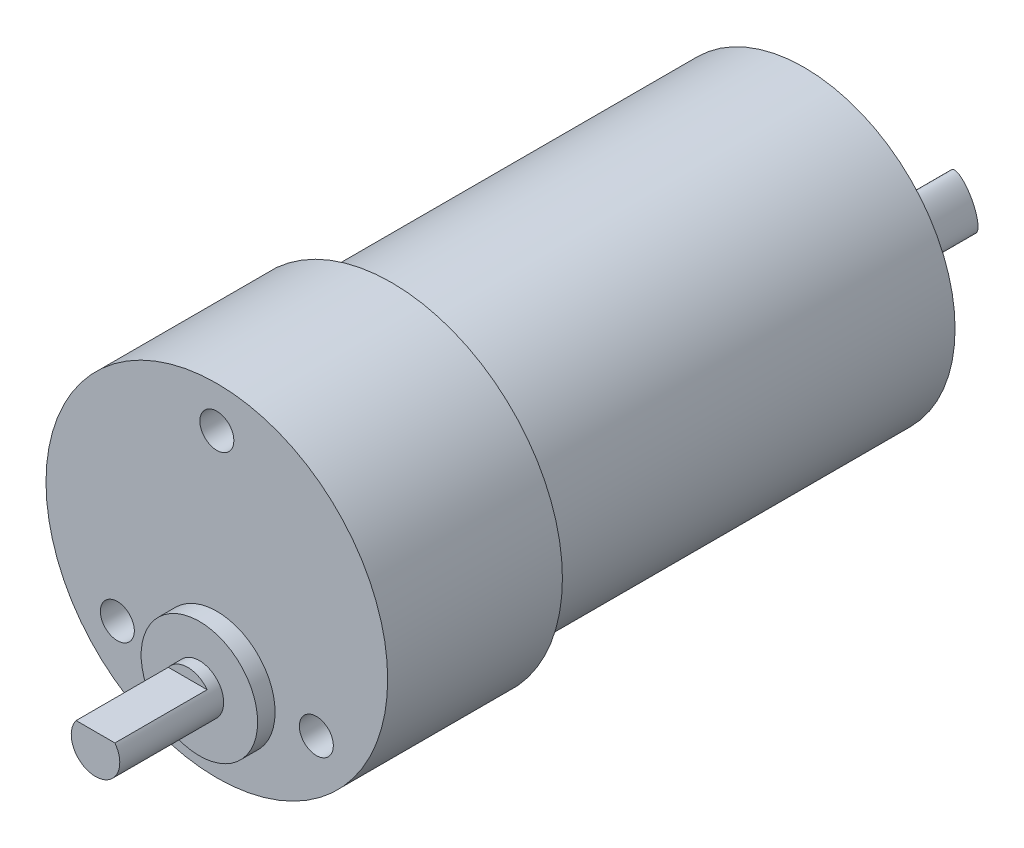
from build123d import *

# Parameters (mm, degrees)
SKETCH1_R              = 15.55
BACK_DEPTH             = 42.5
SKETCH3_R              = 17.6
FRONT_DEPTH            = 18
SKETCH4_R              = 6
SHAFTBEARING_DEPTH     = 1.8
SKETCH5_R              = 1.75
FRONTSCREWHOLES_DEPTH  = 5.5
SKETCH6_R              = 2.5
ROUNDPARTOFSHAFT_DEPTH = 1.2
FLATPARTOFSHAFT_DEPTH  = 9.5
SKETCH8_RX             = 2.553008369
SKETCH8_RY             = 1.011966428
PWR_AND_GND_DEPTH      = 7


with BuildPart() as part:
    # Sketch1 → Back (new body)
    with BuildSketch(Plane.XY):
        Circle(SKETCH1_R)
    extrude(amount=-BACK_DEPTH)

    # Sketch3 → Front (add)
    with BuildSketch(Plane.XY):
        Circle(SKETCH3_R)
    extrude(amount=FRONT_DEPTH)

    # Sketch4 → ShaftBearing (add)
    with BuildSketch(Plane.XY.offset(18)):
        with Locations((0, -8.73)):
            Circle(SKETCH4_R)
    extrude(amount=SHAFTBEARING_DEPTH)

    # Sketch5 → frontScrewHoles (cut)
    with BuildSketch(Plane.XY.offset(18)):
        with Locations((-10.25, -8.73)):
            Circle(SKETCH5_R)
        with Locations((10.250000074, -8.73)):
            Circle(SKETCH5_R)
        with Locations((0, 13.37)):
            Circle(SKETCH5_R)
    extrude(amount=-FRONTSCREWHOLES_DEPTH, mode=Mode.SUBTRACT)

    # Sketch6 → RoundPartofShaft (add)
    with BuildSketch(Plane.XY.offset(19.8)):
        with Locations((0, -8.73)):
            Circle(SKETCH6_R)
    extrude(amount=ROUNDPARTOFSHAFT_DEPTH)

    # Sketch7 → FlatPartofShaft (add)
    with BuildSketch(Plane.XY.offset(21)):
        with BuildLine():
            Line((2, -7.23), (-2, -7.23))
            ThreePointArc((-2, -7.23), (0, -11.23), (2, -7.23))
        make_face()
    extrude(amount=FLATPARTOFSHAFT_DEPTH)

    # Sketch8 → Pwr And Gnd (add)
    with BuildSketch(Plane(origin=(0, 0, -42.5), x_dir=(-1, 0, 0), z_dir=(0, 0, -1))):
        with Locations(Location((9.443035065, -4.815505038), (0, 0, -117.019449203))):
            Ellipse(SKETCH8_RX, SKETCH8_RY)
        with Locations(Location((-9.44630216, 4.809093002), (0, 0, 63.019449203))):
            Ellipse(SKETCH8_RX, SKETCH8_RY)
    extrude(amount=PWR_AND_GND_DEPTH)


solid = part.part
